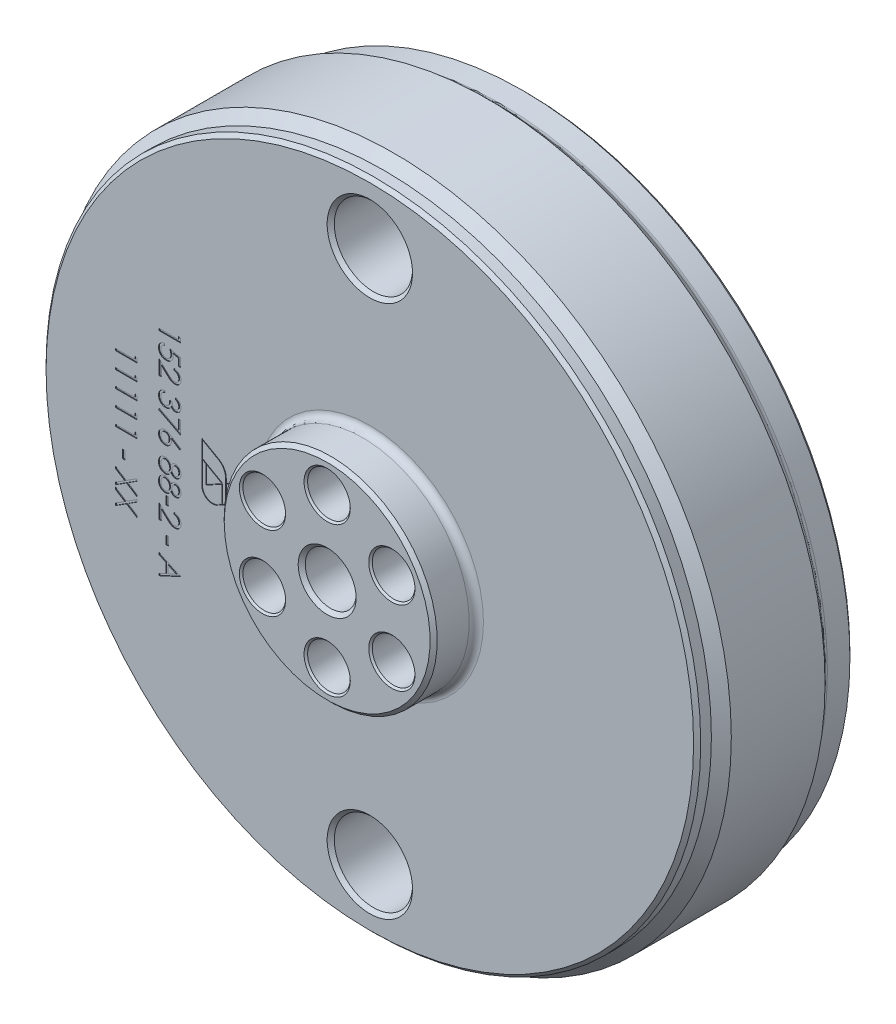
from build123d import *

# Parameters (mm, degrees)
F_11_0_11_DIAMETER_HOLE1_D           = 11
F_11_0_11_DIAMETER_HOLE1_DEPTH       = 10
F_11_0_11_DIAMETER_HOLE1_CSINK_D     = 12
F_11_0_11_DIAMETER_HOLE1_CSINK_ANGLE = 90
F_11_0_11_DIAMETER_HOLE1_TIP         = 3.304733405
CIRPATTERN1_COUNT                    = 6
SKETCH18_W                           = 0.307692308
SKETCH18_H                           = 1.153846154
SKETCH18_W_2                         = 0.307692307
CUT_EXTRUDE1_DEPTH                   = 0.1


with BuildPart() as part:
    # Sketch1 → Revolve1 (revolve)
    with BuildSketch(Plane(origin=(0, 0, 0), x_dir=(0, 0, -1), z_dir=(1, 0, 0)), mode=Mode.PRIVATE) as revolve1_sk:
        with BuildLine():
            Line((0, 36.85), (0, 45.525))
            Line((0, 45.525), (-0.5, 46.025))
            Line((-0.5, 46.025), (-3.66862915, 46.025))
            ThreePointArc((-3.66862915, 46.025), (-3.974775896, 46.085896374), (-4.234314575, 46.259314575))
            Line((-4.234314575, 46.259314575), (-5.4, 47.425))
            Line((-5.4, 47.425), (-18.58, 47.425))
            Line((-18.58, 47.425), (-19.98, 46.025))
            Line((-19.98, 46.025), (-21.48, 46.025))
            Line((-21.48, 46.025), (-21.98, 45.525))
            Line((-21.98, 45.525), (-21.98, 15.975))
            ThreePointArc((-21.98, 15.975), (-22.272893219, 15.267893219), (-22.98, 14.975))
            Line((-22.98, 14.975), (-27.48, 14.975))
            Line((-27.48, 14.975), (-27.98, 14.475))
            Line((-27.98, 14.475), (-27.98, 4.075))
            Line((-27.98, 4.075), (-27.48, 3.575))
            Line((-27.48, 3.575), (-10.7, 3.575))
            Line((-10.7, 3.575), (-8.2, 6.075))
            Line((-8.2, 6.075), (-8.2, 24.107943651))
            ThreePointArc((-8.2, 24.107943651), (-6.29101439, 30.601896882), (-1.171428571, 35.029706236))
            ThreePointArc((-1.171428571, 35.029706236), (-0.318164268, 35.767674461), (0, 36.85))
        make_face()
    revolve(revolve1_sk.sketch.rotate(Axis((0, 0, 0), (0, 0, 1)), 90), axis=Axis((0, 0, 0), (0, 0, 1)))

    # Ø11.0 (11) Diameter Hole1
    with Locations(Plane.XY.offset(21.98)):
        with Locations((0, -37.5), (0, 37.5)):
            CounterSinkHole(F_11_0_11_DIAMETER_HOLE1_D / 2, F_11_0_11_DIAMETER_HOLE1_CSINK_D / 2, depth=F_11_0_11_DIAMETER_HOLE1_DEPTH, counter_sink_angle=F_11_0_11_DIAMETER_HOLE1_CSINK_ANGLE)
            with Locations((0, 0, -(F_11_0_11_DIAMETER_HOLE1_DEPTH + F_11_0_11_DIAMETER_HOLE1_TIP / 2))):  # 118° drill point
                Cone(0, F_11_0_11_DIAMETER_HOLE1_D / 2, F_11_0_11_DIAMETER_HOLE1_TIP, mode=Mode.SUBTRACT)

    # Sketch22 → Ø6.0 (6) Diameter Hole1 (revolve, cut)
    with BuildSketch(Plane(origin=(0, 10.5, 27.98), x_dir=(0, -1, 0), z_dir=(1, 0, 0))):
        Polygon((0, 0), (0, 19.78), (3.25, 19.78), (3, 19.53), (3, 0.25), (3.25, 0), align=None)
    f_6_0_6_diameter_hole1 = revolve(axis=Axis((0, 10.5, 34.33), (0, 0, -1)), mode=Mode.SUBTRACT)

    # CirPattern1: Ø6.0 (6) Diameter Hole1 ×6 about axis
    cirpattern1_axis = Axis((0, 0, 0), (0, 0, 1))
    for i in range(1, CIRPATTERN1_COUNT):
        add(f_6_0_6_diameter_hole1.rotate(cirpattern1_axis, i * 360 / CIRPATTERN1_COUNT), mode=Mode.SUBTRACT)

    # Sketch18 → Cut-Extrude1 (cut)
    # profile 1 of 21: a face of its own
    with BuildSketch(Plane.XY.offset(21.98)):
        Polygon((-26.628822217, 13.250619533), (-26.628822217, 12.695932033), (-29.628822217, 12.695932033), (-29.628822217, 12.965162802), (-26.936514525, 12.965162802), (-26.936514525, 13.426701264), align=None)
    # profile 2 of 21: a face of its own
    with BuildSketch(Plane.XY.offset(21.98)):
        with BuildLine():
            Line((-26.628822217, 9.695932033), (-26.936514525, 9.695932033))
            Line((-26.936514525, 9.695932033), (-26.936514525, 10.715763764))
            Line((-26.936514525, 10.715763764), (-27.725577025, 10.878023379))
            add(Edge.make_bspline(
                [(-27.725577025, 10.878023379), (-27.71680822, 10.846261201), (-27.699820049, 10.784727004), (-27.68095796, 10.693904266), (-27.669587579, 10.607682378), (-27.668035027, 10.55173206), (-27.667283755, 10.524657994)],
                knots=[0, 0, 0, 0, 1.100273476, 2.13160584, 3.095893838, 4, 4, 4, 4], degree=3))
            add(Edge.make_bspline(
                [(-27.667283755, 10.524657994), (-27.668009033, 10.491157762), (-27.66943511, 10.425287934), (-27.68312257, 10.328910051), (-27.704680861, 10.236916394), (-27.73474862, 10.149464138), (-27.773445423, 10.066364921), (-27.821157772, 9.988082806), (-27.877555645, 9.91417414), (-27.942094898, 9.845615968), (-28.013212867, 9.783516462), (-28.089429113, 9.728701035), (-28.170812963, 9.68311229), (-28.257004543, 9.645605746), (-28.347859233, 9.615847925), (-28.444049538, 9.595987422), (-28.544721858, 9.582777507), (-28.613553999, 9.581300563), (-28.648653948, 9.580547417)],
                knots=[0, 0, 0, 0, 1.052772836, 2.070014431, 3.053871312, 4.019926262, 4.972333346, 5.930471369, 6.896690565, 7.89035727, 8.885779078, 9.861050232, 10.836829716, 11.812751485, 12.812646763, 13.836748493, 14.896881366, 16, 16, 16, 16], degree=3))
            add(Edge.make_bspline(
                [(-28.648653948, 9.580547417), (-28.673101597, 9.581117405), (-28.721666507, 9.582249678), (-28.793789638, 9.588009593), (-28.864388101, 9.599093162), (-28.933460839, 9.613995237), (-29.000915509, 9.633260375), (-29.066727573, 9.656835492), (-29.131099679, 9.684624743), (-29.194036042, 9.715999467), (-29.253596435, 9.752294207), (-29.310700262, 9.790526479), (-29.363245982, 9.832877314), (-29.413151864, 9.877296294), (-29.458458026, 9.925559551), (-29.501103313, 9.97616907), (-29.539235304, 10.030312532), (-29.574308126, 10.087020566), (-29.60571097, 10.146257413), (-29.63190655, 10.208623723), (-29.654867203, 10.272750392), (-29.673538927, 10.339208975), (-29.688025487, 10.40787072), (-29.697890637, 10.47897207), (-29.705068392, 10.552156252), (-29.705518121, 10.601763303), (-29.705745294, 10.626821456)],
                knots=[0, 0, 0, 0, 1.05623316, 2.098192244, 3.122504159, 4.140841222, 5.148757784, 6.150489607, 7.158294732, 8.176043417, 9.185147859, 10.169157858, 11.142149047, 12.097904048, 13.0527185, 13.998867679, 14.954465986, 15.910220987, 16.877849176, 17.847023716, 18.829548819, 19.818454515, 20.826519638, 21.858115382, 22.918063636, 24, 24, 24, 24], degree=3))
            add(Edge.make_bspline(
                [(-29.705745294, 10.626821456), (-29.705153095, 10.656713574), (-29.703988014, 10.715522786), (-29.691801481, 10.801683793), (-29.674343995, 10.884580122), (-29.648094174, 10.96355572), (-29.61515447, 11.039276907), (-29.573787959, 11.110735688), (-29.526255956, 11.179336619), (-29.470918445, 11.243215208), (-29.409866768, 11.302381948), (-29.344324097, 11.356159376), (-29.274029824, 11.403321858), (-29.19958239, 11.444061861), (-29.120853694, 11.478762301), (-29.037608154, 11.506035642), (-28.950264541, 11.528044742), (-28.890133064, 11.537356372), (-28.859591448, 11.542085879)],
                knots=[0, 0, 0, 0, 1.046825758, 2.059506013, 3.044032586, 4.011925612, 4.970610144, 5.93275819, 6.900651216, 7.891265644, 8.889116719, 9.876966323, 10.858259055, 11.851035124, 12.847502422, 13.86866322, 14.9174643, 16, 16, 16, 16], degree=3))
            Line((-28.859591448, 11.542085879), (-28.859591448, 11.27285511))
            add(Edge.make_bspline(
                [(-28.859591448, 11.27285511), (-28.888202565, 11.266234801), (-28.943194721, 11.2535102), (-29.020413833, 11.225506934), (-29.089485567, 11.191478853), (-29.150475131, 11.150095268), (-29.203938981, 11.101727901), (-29.251994253, 11.046931829), (-29.294773601, 10.98492641), (-29.330661809, 10.916051173), (-29.361224019, 10.843345127), (-29.381585545, 10.767261375), (-29.39589983, 10.689857015), (-29.39733287, 10.637504212), (-29.398052986, 10.611196456)],
                knots=[0, 0, 0, 0, 1.136389429, 2.184203582, 3.172920998, 4.111012962, 5.028380909, 5.957351669, 6.927793475, 7.937618031, 8.960409703, 9.974842029, 10.982339866, 12, 12, 12, 12], degree=3))
            add(Edge.make_bspline(
                [(-29.398052986, 10.611196456), (-29.397349462, 10.585517789), (-29.395964218, 10.534956284), (-29.385302208, 10.460546524), (-29.368881432, 10.388706918), (-29.344307271, 10.320146326), (-29.314440369, 10.253665007), (-29.276113161, 10.190944632), (-29.232004574, 10.130170737), (-29.18147032, 10.073232337), (-29.12578201, 10.021084238), (-29.066229959, 9.975007563), (-29.002701233, 9.936627351), (-28.936295673, 9.904283829), (-28.866285482, 9.879723859), (-28.79299876, 9.862203018), (-28.716254491, 9.851914682), (-28.663909369, 9.850499385), (-28.637235679, 9.849778187)],
                knots=[0, 0, 0, 0, 1.027316725, 2.022795036, 3.002884548, 3.971462791, 4.93288096, 5.914575861, 6.907176829, 7.935150275, 8.956128384, 9.956726525, 10.942570165, 11.921478529, 12.907843606, 13.90538589, 14.932640048, 16, 16, 16, 16], degree=3))
            add(Edge.make_bspline(
                [(-28.637235679, 9.849778187), (-28.613156248, 9.850251689), (-28.565997179, 9.851179035), (-28.497306463, 9.861484119), (-28.431840212, 9.875919942), (-28.370183867, 9.898084308), (-28.311434561, 9.925470263), (-28.256849744, 9.960214621), (-28.205027037, 9.999931002), (-28.158071716, 10.046449868), (-28.114441636, 10.097176716), (-28.07730271, 10.153289084), (-28.046044376, 10.213507095), (-28.019072786, 10.277133787), (-27.999700445, 10.34567476), (-27.98515662, 10.417774835), (-27.976743431, 10.494211984), (-27.975576101, 10.546472578), (-27.974976063, 10.573335879)],
                knots=[0, 0, 0, 0, 1.045726679, 2.048034203, 3.01323695, 3.95502507, 4.889743367, 5.8246644, 6.761650845, 7.722168973, 8.692072792, 9.66525385, 10.638902184, 11.638179751, 12.663148338, 13.728659964, 14.832472288, 16, 16, 16, 16], degree=3))
            add(Edge.make_bspline(
                [(-27.974976063, 10.573335879), (-27.975456814, 10.596791184), (-27.976440985, 10.644807836), (-27.984186208, 10.718633355), (-27.996101488, 10.795875298), (-28.013275209, 10.876833542), (-28.03477789, 10.961285912), (-28.061632043, 11.049372853), (-28.092564641, 11.141096492), (-28.116557018, 11.20283307), (-28.128822217, 11.234393571)],
                knots=[0, 0, 0, 0, 0.824638674, 1.688163388, 2.607705698, 3.571998603, 4.597075385, 5.671199175, 6.809488238, 8, 8, 8, 8], degree=3))
            Line((-28.128822217, 11.234393571), (-26.628822217, 10.926701264))
            Line((-26.628822217, 10.926701264), (-26.628822217, 9.695932033))
        make_face()
    # profile 3 of 21: a face of its own
    with BuildSketch(Plane.XY.offset(21.98)):
        with BuildLine():
            Line((-27.55189914, 8.888239725), (-27.55189914, 9.157470494))
            add(Edge.make_bspline(
                [(-27.55189914, 9.157470494), (-27.51618106, 9.15571609), (-27.446031702, 9.152270488), (-27.343756559, 9.136127728), (-27.245986286, 9.113050843), (-27.153559084, 9.080345514), (-27.065370832, 9.03995729), (-26.982592567, 8.990510416), (-26.904402726, 8.933059019), (-26.832281702, 8.867708496), (-26.766354068, 8.796797156), (-26.708819713, 8.720749867), (-26.660764983, 8.640348253), (-26.620373874, 8.556289682), (-26.590092255, 8.467601993), (-26.567613922, 8.375132939), (-26.554092061, 8.278464571), (-26.552638431, 8.212601769), (-26.55189914, 8.17910511)],
                knots=[0, 0, 0, 0, 1.100776268, 2.161895295, 3.184016182, 4.190939212, 5.176500551, 6.166955529, 7.155448256, 8.160289653, 9.16017456, 10.133824356, 11.091467644, 12.04088621, 13.000931625, 13.972173743, 14.968683325, 16, 16, 16, 16], degree=3))
            add(Edge.make_bspline(
                [(-26.55189914, 8.17910511), (-26.552669246, 8.146209618), (-26.554182475, 8.081571151), (-26.567177643, 7.987232281), (-26.587531008, 7.897423172), (-26.616087079, 7.812319372), (-26.654473731, 7.732599888), (-26.700585907, 7.65766585), (-26.753917191, 7.586625155), (-26.816706174, 7.522676483), (-26.883736789, 7.463955272), (-26.955297849, 7.413296196), (-27.029208666, 7.369913485), (-27.106032838, 7.333752616), (-27.18649372, 7.307133069), (-27.269419894, 7.286923176), (-27.355669732, 7.275499679), (-27.414046779, 7.273746459), (-27.443726063, 7.27285511)],
                knots=[0, 0, 0, 0, 1.111607364, 2.184268762, 3.212621178, 4.221274766, 5.211760367, 6.196651075, 7.1921475, 8.207485113, 9.220403448, 10.201281604, 11.166441695, 12.114753415, 13.065576456, 14.026450734, 14.996634279, 16, 16, 16, 16], degree=3))
            add(Edge.make_bspline(
                [(-27.443726063, 7.27285511), (-27.485509907, 7.274304523), (-27.568344347, 7.277177916), (-27.690258855, 7.301856794), (-27.808284761, 7.34025143), (-27.903643566, 7.385879093), (-27.980003694, 7.432628056), (-28.042989268, 7.474678147), (-28.110790087, 7.523941471), (-28.183200423, 7.58109208), (-28.260780833, 7.644960991), (-28.343486482, 7.716122624), (-28.430462252, 7.795085674), (-28.489867058, 7.850507237), (-28.52064914, 7.879225302)],
                knots=[0, 0, 0, 0, 1.184136889, 2.347493852, 3.513608722, 4.697895552, 5.335178528, 6.052199267, 6.845488095, 7.711597353, 8.668264519, 9.695616787, 10.805926351, 12, 12, 12, 12], degree=3))
            Line((-28.52064914, 7.879225302), (-29.321129909, 8.629826264))
            Line((-29.321129909, 8.629826264), (-29.321129909, 7.234393571))
            Line((-29.321129909, 7.234393571), (-29.628822217, 7.234393571))
            Line((-29.628822217, 7.234393571), (-29.628822217, 9.27285511))
            Line((-29.628822217, 9.27285511), (-28.387235679, 8.109393571))
            add(Edge.make_bspline(
                [(-28.387235679, 8.109393571), (-28.357667314, 8.081064806), (-28.300872538, 8.026651044), (-28.217928782, 7.949720935), (-28.141071065, 7.880514184), (-28.069958814, 7.818984883), (-28.004995167, 7.765082406), (-27.94567102, 7.718979216), (-27.892495475, 7.680471545), (-27.830027069, 7.639661439), (-27.753666329, 7.600746295), (-27.660818905, 7.566543865), (-27.565028397, 7.545838179), (-27.500315611, 7.543341653), (-27.467764525, 7.542085879)],
                knots=[0, 0, 0, 0, 1.329530082, 2.553755191, 3.672934919, 4.687409497, 5.60679272, 6.413407421, 7.126401618, 7.737995624, 8.834647426, 9.90044882, 10.943907757, 12, 12, 12, 12], degree=3))
            add(Edge.make_bspline(
                [(-27.467764525, 7.542085879), (-27.447292493, 7.542625203), (-27.406946049, 7.543688109), (-27.347830711, 7.553246448), (-27.29058597, 7.567289546), (-27.235919617, 7.588934297), (-27.18275647, 7.614939669), (-27.132712854, 7.64816345), (-27.084082903, 7.686129507), (-27.038534097, 7.73016827), (-26.996804317, 7.77851465), (-26.959841607, 7.829597094), (-26.928950734, 7.883639607), (-26.903627792, 7.940416971), (-26.883763165, 7.999770199), (-26.869998672, 8.061814275), (-26.861356542, 8.126377715), (-26.860187252, 8.170463569), (-26.859591448, 8.192927225)],
                knots=[0, 0, 0, 0, 0.991504627, 1.954065223, 2.895985987, 3.842598665, 4.797835564, 5.759220273, 6.74786863, 7.784730864, 8.824135544, 9.839918996, 10.835834653, 11.835434876, 12.84861661, 13.863796685, 14.911511676, 16, 16, 16, 16], degree=3))
            add(Edge.make_bspline(
                [(-26.859591448, 8.192927225), (-26.860204147, 8.216388043), (-26.861407388, 8.262461216), (-26.869829444, 8.330104624), (-26.884344878, 8.394640667), (-26.90424523, 8.456199986), (-26.929299932, 8.514841892), (-26.961108762, 8.570036145), (-26.998429786, 8.62228665), (-27.040973717, 8.671497442), (-27.088564146, 8.716714439), (-27.140961946, 8.757277759), (-27.198507959, 8.791873983), (-27.259902395, 8.822541979), (-27.326777654, 8.846007534), (-27.397513196, 8.866065665), (-27.473114003, 8.880636414), (-27.525201247, 8.885663194), (-27.55189914, 8.888239725)],
                knots=[0, 0, 0, 0, 1.031212865, 2.025131798, 2.990757446, 3.934781266, 4.865570067, 5.788494791, 6.729227313, 7.684356718, 8.643577152, 9.610526866, 10.590658432, 11.59095419, 12.621640561, 13.700587263, 14.82141059, 16, 16, 16, 16], degree=3))
        make_face()
    # profile 4 of 21: a face of its own
    with BuildSketch(Plane.XY.offset(21.98)):
        with BuildLine():
            Line((-27.321129909, 5.426701264), (-27.321129909, 5.695932033))
            add(Edge.make_bspline(
                [(-27.321129909, 5.695932033), (-27.290930637, 5.688638132), (-27.231893531, 5.674379153), (-27.14754445, 5.644638376), (-27.067724289, 5.612239014), (-26.993927654, 5.573334067), (-26.924671452, 5.530897992), (-26.861526488, 5.482278517), (-26.802886803, 5.429718755), (-26.750846885, 5.371583084), (-26.703723118, 5.31061566), (-26.663544497, 5.245957414), (-26.628980937, 5.178909219), (-26.600506453, 5.109006534), (-26.579056004, 5.036041244), (-26.563493028, 4.960672996), (-26.553386358, 4.882704281), (-26.55239999, 4.829777775), (-26.55189914, 4.802903187)],
                knots=[0, 0, 0, 0, 1.162005537, 2.271625781, 3.343758855, 4.383309926, 5.390229558, 6.379919256, 7.361854164, 8.333198761, 9.295911338, 10.242430842, 11.177959212, 12.116337295, 13.062827104, 14.020064771, 14.994644689, 16, 16, 16, 16], degree=3))
            add(Edge.make_bspline(
                [(-26.55189914, 4.802903187), (-26.553081337, 4.763746551), (-26.555419945, 4.686287398), (-26.576775176, 4.572490501), (-26.610568147, 4.462753227), (-26.657259913, 4.358276729), (-26.714849039, 4.261232358), (-26.783390242, 4.174887056), (-26.861561071, 4.100411189), (-26.947903269, 4.037930294), (-27.04017942, 3.989008866), (-27.135150984, 3.952934832), (-27.232592673, 3.930973391), (-27.298384627, 3.928127199), (-27.331346255, 3.926701264)],
                knots=[0, 0, 0, 0, 1.083050992, 2.142477498, 3.193116406, 4.255571735, 5.30263384, 6.308962982, 7.297363603, 8.282367274, 9.249857812, 10.179914175, 11.08814088, 12, 12, 12, 12], degree=3))
            add(Edge.make_bspline(
                [(-27.331346255, 3.926701264), (-27.363066365, 3.927698627), (-27.425137698, 3.929650313), (-27.515756124, 3.946222061), (-27.60116321, 3.974110286), (-27.681718492, 4.012741511), (-27.756911211, 4.062748554), (-27.826910546, 4.123325152), (-27.892026968, 4.194898862), (-27.929329373, 4.249137952), (-27.948533755, 4.27706184)],
                knots=[0, 0, 0, 0, 1.024540389, 2.004866551, 2.965041327, 3.920577974, 4.882998113, 5.874504559, 6.905732034, 8, 8, 8, 8], degree=3))
            add(Edge.make_bspline(
                [(-27.948533755, 4.27706184), (-27.963943617, 4.245148908), (-27.994475009, 4.181920159), (-28.054351373, 4.09573399), (-28.123485385, 4.017495812), (-28.17743623, 3.973864052), (-28.204543371, 3.951941648)],
                knots=[0, 0, 0, 0, 1.015518401, 2.012035669, 3.001164323, 4, 4, 4, 4], degree=3))
            add(Edge.make_bspline(
                [(-28.204543371, 3.951941648), (-28.224305052, 3.937500336), (-28.263504802, 3.908854198), (-28.326566795, 3.8735953), (-28.390118994, 3.841242885), (-28.456660188, 3.817432445), (-28.524052957, 3.796884978), (-28.59374045, 3.783365429), (-28.665060576, 3.774686419), (-28.713332038, 3.773467709), (-28.737596255, 3.77285511)],
                knots=[0, 0, 0, 0, 1.02516404, 2.033540309, 3.025129118, 4.011046665, 4.991655828, 5.976607087, 6.982917762, 8, 8, 8, 8], degree=3))
            add(Edge.make_bspline(
                [(-28.737596255, 3.77285511), (-28.779602917, 3.774396651), (-28.863418557, 3.777472479), (-28.98727909, 3.804853739), (-29.108145438, 3.847546947), (-29.224226756, 3.907114835), (-29.332609536, 3.98081596), (-29.429142704, 4.068984251), (-29.512678917, 4.169476351), (-29.582250329, 4.28163456), (-29.637904457, 4.403095718), (-29.676522349, 4.533020556), (-29.701676818, 4.669519812), (-29.70437403, 4.763126176), (-29.705745294, 4.810715687)],
                knots=[0, 0, 0, 0, 0.95570045, 1.906903359, 2.87519758, 3.868912786, 4.869932978, 5.851730567, 6.836639976, 7.83677598, 8.849487602, 9.869908895, 10.917060885, 12, 12, 12, 12], degree=3))
            add(Edge.make_bspline(
                [(-29.705745294, 4.810715687), (-29.705001111, 4.842789373), (-29.703536808, 4.905899691), (-29.693526578, 4.998679833), (-29.675243716, 5.087241289), (-29.650640883, 5.171703802), (-29.619447961, 5.252142404), (-29.580603363, 5.328311637), (-29.53490779, 5.400680118), (-29.481821857, 5.468564933), (-29.422437852, 5.531957991), (-29.355701558, 5.589174612), (-29.28284664, 5.64116872), (-29.203026878, 5.686548124), (-29.1172738, 5.727379798), (-29.024489373, 5.760963475), (-28.925503068, 5.790522534), (-28.856522148, 5.804265503), (-28.821129909, 5.811316648)],
                knots=[0, 0, 0, 0, 1.048658725, 2.063410685, 3.046034179, 4.001477787, 4.936774919, 5.862367409, 6.792675028, 7.730719943, 8.675894397, 9.627829632, 10.600096036, 11.597688215, 12.626045268, 13.701542398, 14.82072376, 16, 16, 16, 16], degree=3))
            Line((-28.821129909, 5.811316648), (-28.821129909, 5.542085879))
            add(Edge.make_bspline(
                [(-28.821129909, 5.542085879), (-28.844229064, 5.535071629), (-28.889158925, 5.521428304), (-28.953822044, 5.49820462), (-29.013100375, 5.471746101), (-29.067428766, 5.443362194), (-29.117342254, 5.413552097), (-29.161520998, 5.380196447), (-29.201905457, 5.345765751), (-29.224657982, 5.31981202), (-29.235793371, 5.307109917)],
                knots=[0, 0, 0, 0, 1.198163088, 2.33053128, 3.407730985, 4.417276592, 5.372219308, 6.28897303, 7.162600585, 8, 8, 8, 8], degree=3))
            add(Edge.make_bspline(
                [(-29.235793371, 5.307109917), (-29.248743371, 5.290312852), (-29.274603399, 5.256770569), (-29.307604794, 5.202112086), (-29.336199959, 5.144627897), (-29.358043127, 5.083072462), (-29.376538265, 5.018774088), (-29.388641567, 4.950693489), (-29.396945714, 4.879431303), (-29.397678512, 4.83077322), (-29.398052986, 4.805907994)],
                knots=[0, 0, 0, 0, 0.946170439, 1.889420265, 2.845303464, 3.807233317, 4.801018734, 5.828864929, 6.890507805, 8, 8, 8, 8], degree=3))
            add(Edge.make_bspline(
                [(-29.398052986, 4.805907994), (-29.397525926, 4.777833183), (-29.396495305, 4.722935314), (-29.386989847, 4.642836459), (-29.373206637, 4.566611104), (-29.351647016, 4.495037131), (-29.32578269, 4.427140593), (-29.291921539, 4.364437136), (-29.253680844, 4.305083357), (-29.20919956, 4.250818047), (-29.161120108, 4.201895217), (-29.110112093, 4.159620486), (-29.057757097, 4.123005735), (-29.002833783, 4.093573585), (-28.945880906, 4.070291373), (-28.886685288, 4.054451382), (-28.825745396, 4.043435065), (-28.784320481, 4.042538068), (-28.763437602, 4.042085879)],
                knots=[0, 0, 0, 0, 1.216990249, 2.379719373, 3.493992396, 4.571561497, 5.616923107, 6.638958652, 7.655775068, 8.674704564, 9.676001865, 10.625896028, 11.54399481, 12.441854662, 13.322657739, 14.20572845, 15.095482574, 16, 16, 16, 16], degree=3))
            add(Edge.make_bspline(
                [(-28.763437602, 4.042085879), (-28.735484994, 4.043397543), (-28.679718867, 4.046014343), (-28.597675705, 4.065993475), (-28.51862522, 4.098853998), (-28.443927488, 4.144864338), (-28.374663352, 4.200846006), (-28.313104514, 4.2662571), (-28.261798772, 4.341258075), (-28.226481824, 4.410731798), (-28.202944563, 4.472417801), (-28.186440676, 4.525102549), (-28.173247761, 4.584136906), (-28.16048624, 4.648812176), (-28.14978779, 4.719401129), (-28.140827419, 4.795967359), (-28.133668977, 4.87854167), (-28.130470463, 4.935705412), (-28.128822217, 4.965162802)],
                knots=[0, 0, 0, 0, 1.070481957, 2.135637345, 3.216366529, 4.339485895, 5.485746587, 6.620975969, 7.768829582, 8.956804399, 9.598399438, 10.297751078, 11.070570279, 11.915248466, 12.824061284, 13.805856426, 14.869322739, 16, 16, 16, 16], degree=3))
            Line((-28.128822217, 4.965162802), (-27.821129909, 4.965162802))
            add(Edge.make_bspline(
                [(-27.821129909, 4.965162802), (-27.820497331, 4.928048543), (-27.819258267, 4.855350827), (-27.804375772, 4.749141268), (-27.783557121, 4.647458168), (-27.752404777, 4.55262256), (-27.715013074, 4.466465124), (-27.672851198, 4.391306253), (-27.625083684, 4.328927184), (-27.572337435, 4.279172067), (-27.515105856, 4.242653579), (-27.456080001, 4.215242836), (-27.393886535, 4.199173547), (-27.351466548, 4.197016342), (-27.330144332, 4.195932033)],
                knots=[0, 0, 0, 0, 1.321708579, 2.588902423, 3.815526512, 5.016621128, 6.138757764, 7.158873101, 8.079948563, 8.928590313, 9.728601868, 10.489025425, 11.240515403, 12, 12, 12, 12], degree=3))
            add(Edge.make_bspline(
                [(-27.330144332, 4.195932033), (-27.314477656, 4.196287201), (-27.283309546, 4.196993791), (-27.237774326, 4.20590635), (-27.193628595, 4.21929612), (-27.151072661, 4.237715994), (-27.110353538, 4.262325734), (-27.071421271, 4.291865621), (-27.033623397, 4.326349912), (-26.998768211, 4.366679853), (-26.965890846, 4.410341315), (-26.937469587, 4.457745125), (-26.913379746, 4.507845735), (-26.893476403, 4.560689215), (-26.87851391, 4.616487255), (-26.867768172, 4.674966637), (-26.861050385, 4.736241941), (-26.860083144, 4.778046262), (-26.859591448, 4.799297417)],
                knots=[0, 0, 0, 0, 0.884317272, 1.759307272, 2.611736065, 3.488921043, 4.37244062, 5.294096728, 6.247679003, 7.258495569, 8.302441962, 9.333537773, 10.376747089, 11.440883505, 12.520330301, 13.637364711, 14.798958396, 16, 16, 16, 16], degree=3))
            add(Edge.make_bspline(
                [(-26.859591448, 4.799297417), (-26.86078173, 4.833457119), (-26.863106629, 4.90017896), (-26.883541443, 4.996347448), (-26.915918299, 5.085656786), (-26.955013256, 5.153692486), (-26.993472221, 5.204017695), (-27.026558468, 5.240669099), (-27.064071496, 5.276004807), (-27.107040245, 5.308638214), (-27.153987192, 5.340524782), (-27.205170905, 5.371360042), (-27.261321111, 5.400153566), (-27.300807553, 5.417680655), (-27.321129909, 5.426701264)],
                knots=[0, 0, 0, 0, 1.4727372, 2.876598283, 4.222346151, 5.558423782, 6.24313385, 6.953189256, 7.68715613, 8.463578749, 9.278833271, 10.135787152, 11.040551781, 12, 12, 12, 12], degree=3))
        make_face()
    # profile 5 of 21: a face of its own
    with BuildSketch(Plane.XY.offset(21.98)):
        Polygon((-26.628822217, 3.311316648), (-26.628822217, 1.465162802), (-29.705745294, 3.042085879), (-29.577740486, 3.274657994), (-26.936514525, 1.92129261), (-26.936514525, 3.311316648), align=None)
    # profile 6 of 21: a face of its own
    with BuildSketch(Plane.XY.offset(21.98)):
        with BuildLine():
            Line((-26.55189914, -0.188683352), (-26.714759717, -0.396616044))
            Line((-26.714759717, -0.396616044), (-27.92689914, 0.396052225))
            add(Edge.make_bspline(
                [(-27.92689914, 0.396052225), (-27.91848726, 0.343277702), (-27.902078935, 0.240335028), (-27.899372125, 0.136135686), (-27.898052986, 0.08535511)],
                knots=[0, 0, 0, 0, 1.025318673, 2, 2, 2, 2], degree=3))
            add(Edge.make_bspline(
                [(-27.898052986, 0.08535511), (-27.898860641, 0.054862864), (-27.900445227, -0.004961687), (-27.912967724, -0.092865487), (-27.932458922, -0.177351824), (-27.960985473, -0.25823222), (-27.997414072, -0.335609324), (-28.041076501, -0.409925592), (-28.094224079, -0.479784478), (-28.153594082, -0.546085483), (-28.219351486, -0.606280139), (-28.289124064, -0.659573901), (-28.362839104, -0.704339722), (-28.440459275, -0.740660227), (-28.521864926, -0.768864408), (-28.606951903, -0.789425247), (-28.695778878, -0.801579184), (-28.756188743, -0.803229604), (-28.786875102, -0.804067967)],
                knots=[0, 0, 0, 0, 1.044136307, 2.048553127, 3.035567123, 4.010001674, 4.980053131, 5.96154148, 6.956538004, 7.981742224, 9.006487041, 10.005615874, 10.984750588, 11.954802044, 12.935714515, 13.930994945, 14.949008866, 16, 16, 16, 16], degree=3))
            add(Edge.make_bspline(
                [(-28.786875102, -0.804067967), (-28.828832748, -0.802502371), (-28.911346786, -0.799423465), (-29.032030284, -0.777010338), (-29.146080075, -0.738330287), (-29.253944354, -0.686581018), (-29.352484805, -0.61944041), (-29.441538949, -0.539875098), (-29.519162718, -0.447132968), (-29.585752916, -0.343410173), (-29.638658744, -0.231149898), (-29.677773103, -0.113441327), (-29.701144926, 0.00870943), (-29.704204784, 0.091666601), (-29.705745294, 0.133432033)],
                knots=[0, 0, 0, 0, 1.031881447, 2.029301251, 3.006342947, 3.987068354, 4.962916383, 5.929513747, 6.915671209, 7.928552063, 8.953527267, 9.960179832, 10.973036711, 12, 12, 12, 12], degree=3))
            add(Edge.make_bspline(
                [(-29.705745294, 0.133432033), (-29.704435407, 0.173800641), (-29.701840749, 0.253763786), (-29.67872704, 0.371391782), (-29.641263992, 0.484417656), (-29.589651064, 0.592046932), (-29.524461157, 0.69175635), (-29.44596975, 0.780933216), (-29.355911594, 0.859267267), (-29.254010422, 0.924114002), (-29.14521614, 0.976964267), (-29.030740922, 1.014240323), (-28.912888629, 1.038346845), (-28.832665191, 1.04083396), (-28.792283755, 1.042085879)],
                knots=[0, 0, 0, 0, 1.011913813, 2.004424092, 2.994488568, 3.992479987, 4.990471406, 5.973328987, 6.963763268, 7.974390938, 8.994854117, 9.989689954, 10.988086187, 12, 12, 12, 12], degree=3))
            add(Edge.make_bspline(
                [(-28.792283755, 1.042085879), (-28.761399648, 1.040998638), (-28.698368261, 1.038779686), (-28.602629313, 1.02553724), (-28.505051687, 1.001248976), (-28.422332556, 0.974963766), (-28.353826128, 0.948880904), (-28.299728412, 0.924696273), (-28.242599486, 0.897654909), (-28.183520287, 0.865958665), (-28.120802794, 0.832358088), (-28.056769627, 0.793108801), (-27.989082096, 0.752151568), (-27.94401679, 0.722147342), (-27.920889525, 0.70674934)],
                knots=[0, 0, 0, 0, 1.17367173, 2.395347028, 3.66355231, 4.98980831, 5.690886799, 6.447442954, 7.240630024, 8.091733897, 8.994365608, 9.943299771, 10.944512865, 12, 12, 12, 12], degree=3))
            Line((-27.920889525, 0.70674934), (-26.55189914, -0.188683352))
        make_face()
        with BuildLine():
            add(Edge.make_bspline(
                [(-28.205745294, 0.141845494), (-28.206421024, 0.164698129), (-28.207746801, 0.209534809), (-28.215234769, 0.275233742), (-28.229422502, 0.337245535), (-28.24777439, 0.396278898), (-28.27276277, 0.451716982), (-28.30275233, 0.504197966), (-28.338421284, 0.553179575), (-28.379311107, 0.597882168), (-28.423695616, 0.638779694), (-28.47087143, 0.674782998), (-28.520647346, 0.705133962), (-28.572595096, 0.729931898), (-28.626986151, 0.749197801), (-28.683520384, 0.763145088), (-28.7425904, 0.770904618), (-28.782646747, 0.772195788), (-28.803101063, 0.77285511)],
                knots=[0, 0, 0, 0, 1.129054775, 2.21519617, 3.259426851, 4.267013074, 5.263608451, 6.256463875, 7.247987236, 8.249677815, 9.244060445, 10.225610515, 11.175892485, 12.118571871, 13.063688666, 14.021206195, 14.989551517, 16, 16, 16, 16], degree=3))
            add(Edge.make_bspline(
                [(-28.803101063, 0.77285511), (-28.823371703, 0.772316845), (-28.86311941, 0.771261388), (-28.92170686, 0.761721998), (-28.978035481, 0.747046454), (-29.03214647, 0.725565348), (-29.083744662, 0.698621759), (-29.133196572, 0.665464702), (-29.180536334, 0.626655605), (-29.224570207, 0.581540801), (-29.264959146, 0.532888859), (-29.300921532, 0.481436207), (-29.331120321, 0.427346446), (-29.354994843, 0.370310933), (-29.374548646, 0.311128212), (-29.388318344, 0.249346796), (-29.396100918, 0.184912401), (-29.397393756, 0.141265097), (-29.398052986, 0.119008956)],
                knots=[0, 0, 0, 0, 0.989642335, 1.94054129, 2.892446913, 3.828371744, 4.778262963, 5.730973156, 6.732161388, 7.763274768, 8.805796303, 9.818398792, 10.825975928, 11.825728216, 12.834635236, 13.867465554, 14.912602056, 16, 16, 16, 16], degree=3))
            add(Edge.make_bspline(
                [(-29.398052986, 0.119008956), (-29.397393808, 0.096752778), (-29.396101071, 0.053105402), (-29.388317763, -0.011328474), (-29.374550781, -0.073111806), (-29.354987106, -0.132287564), (-29.331149022, -0.189348782), (-29.300732302, -0.243485891), (-29.265177799, -0.295429779), (-29.224500693, -0.344049804), (-29.180785146, -0.389353176), (-29.132767943, -0.427253278), (-29.084137698, -0.461457841), (-29.031940854, -0.487366603), (-28.978068055, -0.509086942), (-28.921698134, -0.523688441), (-28.863121694, -0.533247573), (-28.823372474, -0.534300317), (-28.803101063, -0.534837198)],
                knots=[0, 0, 0, 0, 1.087205562, 2.132157158, 3.164804748, 4.173533273, 5.173108684, 6.180507559, 7.20098426, 8.243321352, 9.274252308, 10.269075238, 11.227079059, 12.172305571, 13.108064818, 14.05980203, 15.010532752, 16, 16, 16, 16], degree=3))
            add(Edge.make_bspline(
                [(-28.803101063, -0.534837198), (-28.782617642, -0.534371016), (-28.742415349, -0.533456052), (-28.683574121, -0.522906902), (-28.626524504, -0.508658519), (-28.572551631, -0.485631826), (-28.520162935, -0.458205156), (-28.470855725, -0.423265379), (-28.423233118, -0.38320607), (-28.37904829, -0.336813503), (-28.338633252, -0.286342544), (-28.302960203, -0.232670356), (-28.272852868, -0.176521108), (-28.247732503, -0.11794904), (-28.229604565, -0.056283738), (-28.215329597, 0.007479395), (-28.207759228, 0.073956741), (-28.206423228, 0.118992669), (-28.205745294, 0.141845494)],
                knots=[0, 0, 0, 0, 0.978850575, 1.921165339, 2.853482305, 3.786193361, 4.721019802, 5.678231452, 6.671107257, 7.694736563, 8.738100728, 9.761595396, 10.773671158, 11.783065439, 12.804898115, 13.84455739, 14.906252091, 16, 16, 16, 16], degree=3))
        make_face(mode=Mode.SUBTRACT)
    # profile 7 of 21: a face of its own
    with BuildSketch(Plane.XY.offset(21.98)):
        with BuildLine():
            add(Edge.make_bspline(
                [(-27.957548179, -3.724140083), (-27.970367794, -3.74848838), (-27.995448533, -3.796124233), (-28.035702991, -3.864282104), (-28.077754049, -3.927033916), (-28.12028169, -3.985273966), (-28.164966904, -4.037814353), (-28.211299639, -4.085002739), (-28.258038789, -4.128319544), (-28.307013179, -4.165487447), (-28.357212701, -4.198262696), (-28.409068868, -4.2265496), (-28.462418118, -4.250738217), (-28.51785598, -4.269905801), (-28.574564618, -4.285696085), (-28.633277216, -4.296560842), (-28.69360664, -4.302403927), (-28.734379471, -4.303508622), (-28.75502414, -4.304067967)],
                knots=[0, 0, 0, 0, 1.264385854, 2.473688339, 3.635349404, 4.734491366, 5.785876313, 6.801388178, 7.772322209, 8.711311751, 9.622826105, 10.524996139, 11.423212571, 12.31118177, 13.217849097, 14.126010572, 15.051135535, 16, 16, 16, 16], degree=3))
            add(Edge.make_bspline(
                [(-28.75502414, -4.304067967), (-28.783909894, -4.303412631), (-28.84108564, -4.302115476), (-28.925439186, -4.290629976), (-29.00755858, -4.273867129), (-29.08664991, -4.247763752), (-29.163704286, -4.216584894), (-29.23731283, -4.176475117), (-29.309533821, -4.13146321), (-29.353945937, -4.095235598), (-29.376418371, -4.076904506)],
                knots=[0, 0, 0, 0, 1.02534174, 2.029536028, 3.018826961, 3.997522084, 4.983122576, 5.966563916, 6.971085759, 8, 8, 8, 8], degree=3))
            add(Edge.make_bspline(
                [(-29.376418371, -4.076904506), (-29.402641606, -4.053044671), (-29.454764028, -4.005619843), (-29.522436151, -3.924377334), (-29.57930706, -3.835215719), (-29.625654398, -3.738480005), (-29.661727992, -3.634428775), (-29.68765015, -3.5230842), (-29.702497946, -3.404229212), (-29.704644223, -3.322538808), (-29.705745294, -3.280630467)],
                knots=[0, 0, 0, 0, 0.954267603, 1.896743057, 2.838368354, 3.796610408, 4.779680527, 5.799409237, 6.871065594, 8, 8, 8, 8], degree=3))
            add(Edge.make_bspline(
                [(-29.705745294, -3.280630467), (-29.704754805, -3.240334205), (-29.702827413, -3.161921772), (-29.689840111, -3.047773673), (-29.666847624, -2.941240529), (-29.636028437, -2.841817271), (-29.594930351, -2.750465198), (-29.544555976, -2.667018544), (-29.486043131, -2.59025304), (-29.417981644, -2.52258136), (-29.345072863, -2.462506413), (-29.269857716, -2.409733577), (-29.192326134, -2.365870137), (-29.113634997, -2.328732612), (-29.032681142, -2.300302882), (-28.949881133, -2.280612415), (-28.865379581, -2.268107289), (-28.80835245, -2.266443459), (-28.779663563, -2.265606429)],
                knots=[0, 0, 0, 0, 1.256882982, 2.445766618, 3.576898315, 4.651879663, 5.686612882, 6.692806257, 7.686348993, 8.689277895, 9.678883454, 10.630458183, 11.551151498, 12.454054546, 13.341321255, 14.221808008, 15.105437234, 16, 16, 16, 16], degree=3))
            add(Edge.make_bspline(
                [(-28.779663563, -2.265606429), (-28.758612811, -2.266101731), (-28.717009095, -2.267080624), (-28.655544187, -2.273856554), (-28.595718075, -2.284748241), (-28.537314882, -2.299546796), (-28.480740938, -2.319578695), (-28.425798562, -2.343851804), (-28.372065617, -2.371880546), (-28.320465834, -2.405476062), (-28.269279562, -2.44246309), (-28.221006949, -2.486338112), (-28.172958823, -2.534458726), (-28.127214223, -2.588789638), (-28.081574483, -2.647667914), (-28.038944044, -2.712878108), (-27.996203761, -2.782588114), (-27.970654455, -2.832136319), (-27.957548179, -2.857553544)],
                knots=[0, 0, 0, 0, 0.941717298, 1.86116577, 2.762973304, 3.660719123, 4.553575492, 5.444450535, 6.34648071, 7.261375261, 8.197060099, 9.168336537, 10.175980388, 11.237504102, 12.343496232, 13.506792996, 14.721035322, 16, 16, 16, 16], degree=3))
            add(Edge.make_bspline(
                [(-27.957548179, -2.857553544), (-27.938578475, -2.822757333), (-27.901847821, -2.75538213), (-27.834310522, -2.666228569), (-27.761431019, -2.589526422), (-27.680800623, -2.528248221), (-27.595970596, -2.479623466), (-27.507212779, -2.445286343), (-27.415589961, -2.422863777), (-27.353109808, -2.420593012), (-27.321730871, -2.419452583)],
                knots=[0, 0, 0, 0, 1.16709546, 2.25982348, 3.287408737, 4.277418348, 5.234967981, 6.16072867, 7.076276605, 8, 8, 8, 8], degree=3))
            add(Edge.make_bspline(
                [(-27.321730871, -2.419452583), (-27.289761569, -2.420854402), (-27.225497697, -2.423672303), (-27.129834784, -2.446457588), (-27.035879822, -2.483590751), (-26.944075208, -2.534087825), (-26.85757843, -2.597016762), (-26.779738774, -2.672499389), (-26.712142961, -2.759244157), (-26.655035802, -2.855710907), (-26.608325677, -2.959321009), (-26.576439534, -3.068827611), (-26.555467428, -3.182273794), (-26.553099676, -3.259501886), (-26.55189914, -3.298659313)],
                knots=[0, 0, 0, 0, 0.888753872, 1.786550278, 2.720173491, 3.693036334, 4.694165094, 5.687489879, 6.699912706, 7.744713188, 8.800178723, 9.852977058, 10.911381959, 12, 12, 12, 12], degree=3))
            add(Edge.make_bspline(
                [(-26.55189914, -3.298659313), (-26.553133553, -3.336806816), (-26.555567674, -3.412029346), (-26.576067974, -3.522764698), (-26.6099266, -3.628805059), (-26.656029321, -3.729571796), (-26.713520799, -3.822863185), (-26.781798533, -3.906157955), (-26.859364683, -3.979222997), (-26.945627203, -4.039929017), (-27.037429591, -4.088919307), (-27.132905759, -4.123807878), (-27.230776303, -4.145999853), (-27.296976522, -4.148812576), (-27.330144332, -4.150221813)],
                knots=[0, 0, 0, 0, 1.072712831, 2.115267497, 3.156282165, 4.197922255, 5.225560591, 6.230883479, 7.219814004, 8.214446311, 9.19021444, 10.138875805, 11.067534608, 12, 12, 12, 12], degree=3))
            add(Edge.make_bspline(
                [(-27.330144332, -4.150221813), (-27.362695952, -4.148992367), (-27.426625482, -4.146577803), (-27.519816888, -4.126261049), (-27.607103196, -4.092059041), (-27.689412471, -4.04531409), (-27.765605919, -3.98448411), (-27.835430216, -3.909673308), (-27.901661043, -3.823203376), (-27.938502716, -3.757899305), (-27.957548179, -3.724140083)],
                knots=[0, 0, 0, 0, 0.975287281, 1.915408787, 2.843441052, 3.776938647, 4.743139116, 5.754296123, 6.83907365, 8, 8, 8, 8], degree=3))
        make_face()
        with BuildLine():
            add(Edge.make_bspline(
                [(-26.859591448, -3.283635275), (-26.860149825, -3.262591727), (-26.861242256, -3.221421346), (-26.866949659, -3.161053914), (-26.878052417, -3.103649027), (-26.892828455, -3.048606913), (-26.912789588, -2.996682216), (-26.936271024, -2.947169741), (-26.96481908, -2.90091215), (-26.996842964, -2.857351033), (-27.032065455, -2.818136083), (-27.068762928, -2.783332182), (-27.107656122, -2.75442237), (-27.147777573, -2.729872847), (-27.190318067, -2.712060118), (-27.233973361, -2.698719286), (-27.279295119, -2.689700951), (-27.31026927, -2.689025188), (-27.325937602, -2.688683352)],
                knots=[0, 0, 0, 0, 1.203892937, 2.355340988, 3.463153438, 4.544400666, 5.610487187, 6.640501085, 7.674077295, 8.714426146, 9.728707835, 10.68524104, 11.601827946, 12.495867327, 13.368432065, 14.231010473, 15.105153427, 16, 16, 16, 16], degree=3))
            add(Edge.make_bspline(
                [(-27.325937602, -2.688683352), (-27.34159955, -2.68929287), (-27.37254981, -2.690497365), (-27.418437891, -2.699215543), (-27.462944908, -2.71379241), (-27.506486346, -2.733780428), (-27.548950442, -2.759431308), (-27.590499918, -2.790563816), (-27.630036028, -2.828528784), (-27.668680491, -2.870453565), (-27.704284206, -2.91624897), (-27.736087393, -2.964371609), (-27.761440614, -3.015172686), (-27.783670207, -3.067130826), (-27.800344979, -3.121344821), (-27.81235817, -3.177440861), (-27.819789078, -3.235359024), (-27.820679429, -3.274598856), (-27.821129909, -3.294452583)],
                knots=[0, 0, 0, 0, 0.873213166, 1.72559466, 2.594724523, 3.479581045, 4.391597569, 5.35687048, 6.368548091, 7.443976143, 8.534559525, 9.600545123, 10.654815915, 11.696401765, 12.749428718, 13.812189468, 14.893058657, 16, 16, 16, 16], degree=3))
            add(Edge.make_bspline(
                [(-27.821129909, -3.294452583), (-27.820381737, -3.319952672), (-27.818892783, -3.370700987), (-27.80504892, -3.445511842), (-27.783272419, -3.518251252), (-27.753478163, -3.588141741), (-27.716082854, -3.653374243), (-27.671311696, -3.711522873), (-27.62019847, -3.762091638), (-27.563538896, -3.804555018), (-27.503237535, -3.837477744), (-27.442722998, -3.863107865), (-27.381349657, -3.878074621), (-27.340235117, -3.880026821), (-27.319927986, -3.880991044)],
                knots=[0, 0, 0, 0, 1.076279235, 2.141928126, 3.20205304, 4.278698113, 5.344010996, 6.36967002, 7.368914609, 8.37248503, 9.349703398, 10.264243087, 11.142681841, 12, 12, 12, 12], degree=3))
            add(Edge.make_bspline(
                [(-27.319927986, -3.880991044), (-27.305674697, -3.880536311), (-27.27738396, -3.87963373), (-27.235618327, -3.872159205), (-27.194754249, -3.85990346), (-27.154781823, -3.842998905), (-27.115138961, -3.822057168), (-27.077499249, -3.795004297), (-27.039767946, -3.764294721), (-27.003617179, -3.728620323), (-26.969576834, -3.688403323), (-26.940293384, -3.643008809), (-26.91486118, -3.593591479), (-26.894426056, -3.539748169), (-26.879035213, -3.481688978), (-26.867521714, -3.419635668), (-26.861029512, -3.353083935), (-26.860081199, -3.307286913), (-26.859591448, -3.283635275)],
                knots=[0, 0, 0, 0, 0.814272661, 1.61621452, 2.416847352, 3.248328223, 4.093649164, 4.973549185, 5.892801723, 6.872536627, 7.872406081, 8.898230315, 9.953166191, 11.044090313, 12.18293744, 13.382234284, 14.648068262, 16, 16, 16, 16], degree=3))
        make_face(mode=Mode.SUBTRACT)
        with BuildLine():
            add(Edge.make_bspline(
                [(-28.128822217, -3.30106316), (-28.129296588, -3.274383819), (-28.130227188, -3.222045464), (-28.140592147, -3.145369448), (-28.155008133, -3.071776101), (-28.176925027, -3.001542529), (-28.20518761, -2.934754837), (-28.239766153, -2.871262575), (-28.280029498, -2.810975899), (-28.326197619, -2.754882613), (-28.376198865, -2.703775785), (-28.428455587, -2.658150221), (-28.483343124, -2.62017207), (-28.540371862, -2.589138977), (-28.599470757, -2.565099782), (-28.66062794, -2.547349508), (-28.724026206, -2.537045735), (-28.767007235, -2.535577481), (-28.788677986, -2.534837198)],
                knots=[0, 0, 0, 0, 1.140506561, 2.237395584, 3.304560074, 4.345354409, 5.3782877, 6.402081073, 7.433555996, 8.474808822, 9.504965884, 10.489266388, 11.437701257, 12.354123303, 13.261162422, 14.161620169, 15.073101032, 16, 16, 16, 16], degree=3))
            add(Edge.make_bspline(
                [(-28.788677986, -2.534837198), (-28.815620487, -2.536002482), (-28.86907378, -2.538314378), (-28.948045106, -2.556753626), (-29.024712752, -2.586116973), (-29.097727734, -2.628081605), (-29.16618049, -2.678957327), (-29.226533556, -2.741108666), (-29.279002045, -2.812106218), (-29.322023475, -2.892658201), (-29.35653333, -2.980526727), (-29.380014535, -3.075939526), (-29.395676452, -3.177549537), (-29.397248324, -3.247716096), (-29.398052986, -3.283635275)],
                knots=[0, 0, 0, 0, 0.898956152, 1.783507998, 2.694187257, 3.631865312, 4.587204618, 5.533364321, 6.51415483, 7.525942309, 8.574485006, 9.65837228, 10.801290154, 12, 12, 12, 12], degree=3))
            add(Edge.make_bspline(
                [(-29.398052986, -3.283635275), (-29.397514618, -3.311707261), (-29.396465704, -3.366400491), (-29.387187855, -3.446185098), (-29.37251828, -3.52149235), (-29.350977883, -3.592285294), (-29.325171183, -3.659412287), (-29.291421482, -3.721372247), (-29.253253359, -3.779815485), (-29.207951105, -3.831998491), (-29.159502876, -3.879454985), (-29.108478111, -3.921020784), (-29.055396458, -3.956198817), (-29.000286784, -3.984555547), (-28.943352175, -4.007073536), (-28.884358769, -4.023306433), (-28.823074884, -4.033311228), (-28.781504559, -4.034323887), (-28.760432794, -4.034837198)],
                knots=[0, 0, 0, 0, 1.22469164, 2.386092043, 3.500511288, 4.568136916, 5.611981868, 6.63276519, 7.641422348, 8.65223666, 9.641383647, 10.598487484, 11.519869765, 12.415254456, 13.298392158, 14.187051141, 15.081026348, 16, 16, 16, 16], degree=3))
            add(Edge.make_bspline(
                [(-28.760432794, -4.034837198), (-28.739964207, -4.034065844), (-28.69960373, -4.03254487), (-28.639837131, -4.022753912), (-28.581860948, -4.005942734), (-28.525924662, -3.981441345), (-28.471423714, -3.951307847), (-28.418760785, -3.91434509), (-28.368353512, -3.870120073), (-28.32014932, -3.820028063), (-28.275560893, -3.765469866), (-28.236120869, -3.707467714), (-28.202904526, -3.646478634), (-28.175890452, -3.582628902), (-28.154644032, -3.51606103), (-28.139801755, -3.446823782), (-28.130459237, -3.374836149), (-28.129374055, -3.325931974), (-28.128822217, -3.30106316)],
                knots=[0, 0, 0, 0, 0.917481483, 1.809113215, 2.707052678, 3.61610275, 4.54058801, 5.494688304, 6.493986409, 7.541809048, 8.607637092, 9.648666143, 10.681335566, 11.715370464, 12.751897579, 13.808646822, 14.885650252, 16, 16, 16, 16], degree=3))
        make_face(mode=Mode.SUBTRACT)
    # profile 8 of 21: a face of its own
    with BuildSketch(Plane.XY.offset(21.98)):
        with BuildLine():
            add(Edge.make_bspline(
                [(-27.957548179, -6.03183239), (-27.970367794, -6.056180687), (-27.995448533, -6.10381654), (-28.035702991, -6.171974411), (-28.077754049, -6.234726224), (-28.12028169, -6.292966274), (-28.164966904, -6.345506661), (-28.211299639, -6.392695046), (-28.258038789, -6.436011852), (-28.307013179, -6.473179755), (-28.357212701, -6.505955004), (-28.409068868, -6.534241908), (-28.462418118, -6.558430525), (-28.51785598, -6.577598109), (-28.574564618, -6.593388393), (-28.633277216, -6.604253149), (-28.69360664, -6.610096235), (-28.734379471, -6.61120093), (-28.75502414, -6.611760275)],
                knots=[0, 0, 0, 0, 1.264385854, 2.473688339, 3.635349404, 4.734491366, 5.785876313, 6.801388178, 7.772322209, 8.711311751, 9.622826105, 10.524996139, 11.423212571, 12.31118177, 13.217849097, 14.126010572, 15.051135535, 16, 16, 16, 16], degree=3))
            add(Edge.make_bspline(
                [(-28.75502414, -6.611760275), (-28.783909894, -6.611104939), (-28.84108564, -6.609807783), (-28.925439186, -6.598322284), (-29.00755858, -6.581559437), (-29.08664991, -6.55545606), (-29.163704286, -6.524277202), (-29.23731283, -6.484167425), (-29.309533821, -6.439155518), (-29.353945937, -6.402927906), (-29.376418371, -6.384596813)],
                knots=[0, 0, 0, 0, 1.02534174, 2.029536028, 3.018826961, 3.997522084, 4.983122576, 5.966563916, 6.971085759, 8, 8, 8, 8], degree=3))
            add(Edge.make_bspline(
                [(-29.376418371, -6.384596813), (-29.402641606, -6.360736978), (-29.454764028, -6.313312151), (-29.522436151, -6.232069641), (-29.57930706, -6.142908027), (-29.625654398, -6.046172313), (-29.661727992, -5.942121083), (-29.68765015, -5.830776508), (-29.702497946, -5.711921519), (-29.704644223, -5.630231116), (-29.705745294, -5.588322775)],
                knots=[0, 0, 0, 0, 0.954267603, 1.896743057, 2.838368354, 3.796610408, 4.779680527, 5.799409237, 6.871065594, 8, 8, 8, 8], degree=3))
            add(Edge.make_bspline(
                [(-29.705745294, -5.588322775), (-29.704754805, -5.548026513), (-29.702827413, -5.469614079), (-29.689840111, -5.35546598), (-29.666847624, -5.248932837), (-29.636028437, -5.149509579), (-29.594930351, -5.058157506), (-29.544555976, -4.974710852), (-29.486043131, -4.897945347), (-29.417981644, -4.830273668), (-29.345072863, -4.770198721), (-29.269857716, -4.717425884), (-29.192326134, -4.673562444), (-29.113634997, -4.63642492), (-29.032681142, -4.60799519), (-28.949881133, -4.588304723), (-28.865379581, -4.575799597), (-28.80835245, -4.574135767), (-28.779663563, -4.573298736)],
                knots=[0, 0, 0, 0, 1.256882982, 2.445766618, 3.576898315, 4.651879663, 5.686612882, 6.692806257, 7.686348993, 8.689277895, 9.678883454, 10.630458183, 11.551151498, 12.454054546, 13.341321255, 14.221808008, 15.105437234, 16, 16, 16, 16], degree=3))
            add(Edge.make_bspline(
                [(-28.779663563, -4.573298736), (-28.758612811, -4.573794039), (-28.717009095, -4.574772932), (-28.655544187, -4.581548862), (-28.595718075, -4.592440549), (-28.537314882, -4.607239103), (-28.480740938, -4.627271003), (-28.425798562, -4.651544111), (-28.372065617, -4.679572854), (-28.320465834, -4.71316837), (-28.269279562, -4.750155397), (-28.221006949, -4.79403042), (-28.172958823, -4.842151033), (-28.127214223, -4.896481945), (-28.081574483, -4.955360222), (-28.038944044, -5.020570415), (-27.996203761, -5.090280422), (-27.970654455, -5.139828627), (-27.957548179, -5.165245852)],
                knots=[0, 0, 0, 0, 0.941717298, 1.86116577, 2.762973304, 3.660719123, 4.553575492, 5.444450535, 6.34648071, 7.261375261, 8.197060099, 9.168336537, 10.175980388, 11.237504102, 12.343496232, 13.506792996, 14.721035322, 16, 16, 16, 16], degree=3))
            add(Edge.make_bspline(
                [(-27.957548179, -5.165245852), (-27.938578475, -5.130449641), (-27.901847821, -5.063074437), (-27.834310522, -4.973920877), (-27.761431019, -4.897218729), (-27.680800623, -4.835940529), (-27.595970596, -4.787315774), (-27.507212779, -4.75297865), (-27.415589961, -4.730556085), (-27.353109808, -4.72828532), (-27.321730871, -4.72714489)],
                knots=[0, 0, 0, 0, 1.16709546, 2.25982348, 3.287408737, 4.277418348, 5.234967981, 6.16072867, 7.076276605, 8, 8, 8, 8], degree=3))
            add(Edge.make_bspline(
                [(-27.321730871, -4.72714489), (-27.289761569, -4.72854671), (-27.225497697, -4.731364611), (-27.129834784, -4.754149896), (-27.035879822, -4.791283058), (-26.944075208, -4.841780133), (-26.85757843, -4.90470907), (-26.779738774, -4.980191697), (-26.712142961, -5.066936465), (-26.655035802, -5.163403214), (-26.608325677, -5.267013317), (-26.576439534, -5.376519919), (-26.555467428, -5.489966102), (-26.553099676, -5.567194194), (-26.55189914, -5.606351621)],
                knots=[0, 0, 0, 0, 0.888753872, 1.786550278, 2.720173491, 3.693036334, 4.694165094, 5.687489879, 6.699912706, 7.744713188, 8.800178723, 9.852977058, 10.911381959, 12, 12, 12, 12], degree=3))
            add(Edge.make_bspline(
                [(-26.55189914, -5.606351621), (-26.553133553, -5.644499124), (-26.555567674, -5.719721653), (-26.576067974, -5.830457005), (-26.6099266, -5.936497367), (-26.656029321, -6.037264104), (-26.713520799, -6.130555493), (-26.781798533, -6.213850263), (-26.859364683, -6.286915305), (-26.945627203, -6.347621325), (-27.037429591, -6.396611615), (-27.132905759, -6.431500186), (-27.230776303, -6.453692161), (-27.296976522, -6.456504883), (-27.330144332, -6.457914121)],
                knots=[0, 0, 0, 0, 1.072712831, 2.115267497, 3.156282165, 4.197922255, 5.225560591, 6.230883479, 7.219814004, 8.214446311, 9.19021444, 10.138875805, 11.067534608, 12, 12, 12, 12], degree=3))
            add(Edge.make_bspline(
                [(-27.330144332, -6.457914121), (-27.362695952, -6.456684674), (-27.426625482, -6.454270111), (-27.519816888, -6.433953357), (-27.607103196, -6.399751349), (-27.689412471, -6.353006397), (-27.765605919, -6.292176418), (-27.835430216, -6.217365616), (-27.901661043, -6.130895683), (-27.938502716, -6.065591613), (-27.957548179, -6.03183239)],
                knots=[0, 0, 0, 0, 0.975287281, 1.915408787, 2.843441052, 3.776938647, 4.743139116, 5.754296123, 6.83907365, 8, 8, 8, 8], degree=3))
        make_face()
        with BuildLine():
            add(Edge.make_bspline(
                [(-26.859591448, -5.591327583), (-26.860149825, -5.570284035), (-26.861242256, -5.529113654), (-26.866949659, -5.468746221), (-26.878052417, -5.411341335), (-26.892828455, -5.35629922), (-26.912789588, -5.304374524), (-26.936271024, -5.254862049), (-26.96481908, -5.208604457), (-26.996842964, -5.165043341), (-27.032065455, -5.125828391), (-27.068762928, -5.09102449), (-27.107656122, -5.062114677), (-27.147777573, -5.037565155), (-27.190318067, -5.019752426), (-27.233973361, -5.006411594), (-27.279295119, -4.997393258), (-27.31026927, -4.996717495), (-27.325937602, -4.99637566)],
                knots=[0, 0, 0, 0, 1.203892937, 2.355340988, 3.463153438, 4.544400666, 5.610487187, 6.640501085, 7.674077295, 8.714426146, 9.728707835, 10.68524104, 11.601827946, 12.495867327, 13.368432065, 14.231010473, 15.105153427, 16, 16, 16, 16], degree=3))
            add(Edge.make_bspline(
                [(-27.325937602, -4.99637566), (-27.34159955, -4.996985178), (-27.37254981, -4.998189673), (-27.418437891, -5.006907851), (-27.462944908, -5.021484717), (-27.506486346, -5.041472736), (-27.548950442, -5.067123616), (-27.590499918, -5.098256124), (-27.630036028, -5.136221092), (-27.668680491, -5.178145873), (-27.704284206, -5.223941277), (-27.736087393, -5.272063917), (-27.761440614, -5.322864994), (-27.783670207, -5.374823134), (-27.800344979, -5.429037129), (-27.81235817, -5.485133169), (-27.819789078, -5.543051331), (-27.820679429, -5.582291164), (-27.821129909, -5.60214489)],
                knots=[0, 0, 0, 0, 0.873213166, 1.72559466, 2.594724523, 3.479581045, 4.391597569, 5.35687048, 6.368548091, 7.443976143, 8.534559525, 9.600545123, 10.654815915, 11.696401765, 12.749428718, 13.812189468, 14.893058657, 16, 16, 16, 16], degree=3))
            add(Edge.make_bspline(
                [(-27.821129909, -5.60214489), (-27.820381737, -5.627644979), (-27.818892783, -5.678393294), (-27.80504892, -5.75320415), (-27.783272419, -5.82594356), (-27.753478163, -5.895834049), (-27.716082854, -5.961066551), (-27.671311696, -6.019215181), (-27.62019847, -6.069783946), (-27.563538896, -6.112247326), (-27.503237535, -6.145170052), (-27.442722998, -6.170800173), (-27.381349657, -6.185766929), (-27.340235117, -6.187719129), (-27.319927986, -6.188683352)],
                knots=[0, 0, 0, 0, 1.076279235, 2.141928126, 3.20205304, 4.278698113, 5.344010996, 6.36967002, 7.368914609, 8.37248503, 9.349703398, 10.264243087, 11.142681841, 12, 12, 12, 12], degree=3))
            add(Edge.make_bspline(
                [(-27.319927986, -6.188683352), (-27.305674697, -6.188228618), (-27.27738396, -6.187326038), (-27.235618327, -6.179851513), (-27.194754249, -6.167595767), (-27.154781823, -6.150691213), (-27.115138961, -6.129749475), (-27.077499249, -6.102696605), (-27.039767946, -6.071987029), (-27.003617179, -6.03631263), (-26.969576834, -5.996095631), (-26.940293384, -5.950701117), (-26.91486118, -5.901283787), (-26.894426056, -5.847440477), (-26.879035213, -5.789381286), (-26.867521714, -5.727327976), (-26.861029512, -5.660776243), (-26.860081199, -5.614979221), (-26.859591448, -5.591327583)],
                knots=[0, 0, 0, 0, 0.814272661, 1.61621452, 2.416847352, 3.248328223, 4.093649164, 4.973549185, 5.892801723, 6.872536627, 7.872406081, 8.898230315, 9.953166191, 11.044090313, 12.18293744, 13.382234284, 14.648068262, 16, 16, 16, 16], degree=3))
        make_face(mode=Mode.SUBTRACT)
        with BuildLine():
            add(Edge.make_bspline(
                [(-28.128822217, -5.608755467), (-28.129296588, -5.582076127), (-28.130227188, -5.529737771), (-28.140592147, -5.453061756), (-28.155008133, -5.379468409), (-28.176925027, -5.309234837), (-28.20518761, -5.242447144), (-28.239766153, -5.178954882), (-28.280029498, -5.118668207), (-28.326197619, -5.062574921), (-28.376198865, -5.011468093), (-28.428455587, -4.965842529), (-28.483343124, -4.927864378), (-28.540371862, -4.896831285), (-28.599470757, -4.87279209), (-28.66062794, -4.855041816), (-28.724026206, -4.844738042), (-28.767007235, -4.843269789), (-28.788677986, -4.842529506)],
                knots=[0, 0, 0, 0, 1.140506561, 2.237395584, 3.304560074, 4.345354409, 5.3782877, 6.402081073, 7.433555996, 8.474808822, 9.504965884, 10.489266388, 11.437701257, 12.354123303, 13.261162422, 14.161620169, 15.073101032, 16, 16, 16, 16], degree=3))
            add(Edge.make_bspline(
                [(-28.788677986, -4.842529506), (-28.815620487, -4.843694789), (-28.86907378, -4.846006685), (-28.948045106, -4.864445934), (-29.024712752, -4.893809281), (-29.097727734, -4.935773913), (-29.16618049, -4.986649635), (-29.226533556, -5.048800974), (-29.279002045, -5.119798526), (-29.322023475, -5.200350509), (-29.35653333, -5.288219034), (-29.380014535, -5.383631833), (-29.395676452, -5.485241845), (-29.397248324, -5.555408404), (-29.398052986, -5.591327583)],
                knots=[0, 0, 0, 0, 0.898956152, 1.783507998, 2.694187257, 3.631865312, 4.587204618, 5.533364321, 6.51415483, 7.525942309, 8.574485006, 9.65837228, 10.801290154, 12, 12, 12, 12], degree=3))
            add(Edge.make_bspline(
                [(-29.398052986, -5.591327583), (-29.397514618, -5.619399568), (-29.396465704, -5.674092799), (-29.387187855, -5.753877406), (-29.37251828, -5.829184658), (-29.350977883, -5.899977602), (-29.325171183, -5.967104595), (-29.291421482, -6.029064555), (-29.253253359, -6.087507793), (-29.207951105, -6.139690798), (-29.159502876, -6.187147293), (-29.108478111, -6.228713092), (-29.055396458, -6.263891124), (-29.000286784, -6.292247855), (-28.943352175, -6.314765844), (-28.884358769, -6.330998741), (-28.823074884, -6.341003536), (-28.781504559, -6.342016195), (-28.760432794, -6.342529506)],
                knots=[0, 0, 0, 0, 1.22469164, 2.386092043, 3.500511288, 4.568136916, 5.611981868, 6.63276519, 7.641422348, 8.65223666, 9.641383647, 10.598487484, 11.519869765, 12.415254456, 13.298392158, 14.187051141, 15.081026348, 16, 16, 16, 16], degree=3))
            add(Edge.make_bspline(
                [(-28.760432794, -6.342529506), (-28.739964207, -6.341758152), (-28.69960373, -6.340237178), (-28.639837131, -6.33044622), (-28.581860948, -6.313635041), (-28.525924662, -6.289133653), (-28.471423714, -6.259000154), (-28.418760785, -6.222037398), (-28.368353512, -6.17781238), (-28.32014932, -6.12772037), (-28.275560893, -6.073162174), (-28.236120869, -6.015160021), (-28.202904526, -5.954170942), (-28.175890452, -5.89032121), (-28.154644032, -5.823753338), (-28.139801755, -5.75451609), (-28.130459237, -5.682528457), (-28.129374055, -5.633624282), (-28.128822217, -5.608755467)],
                knots=[0, 0, 0, 0, 0.917481483, 1.809113215, 2.707052678, 3.61610275, 4.54058801, 5.494688304, 6.493986409, 7.541809048, 8.607637092, 9.648666143, 10.681335566, 11.715370464, 12.751897579, 13.808646822, 14.885650252, 16, 16, 16, 16], degree=3))
        make_face(mode=Mode.SUBTRACT)
    # profile 9 of 21: a face of its own
    with BuildSketch(Plane.XY.offset(21.98)):
        with Locations((-28.474976063, -7.457914121)):
            Rectangle(SKETCH18_W, SKETCH18_H)
    # profile 10 of 21: a face of its own
    with BuildSketch(Plane.XY.offset(21.98)):
        with BuildLine():
            Line((-27.55189914, -8.650221813), (-27.55189914, -8.380991044))
            add(Edge.make_bspline(
                [(-27.55189914, -8.380991044), (-27.51618106, -8.382745448), (-27.446031702, -8.386191051), (-27.343756559, -8.402333811), (-27.245986286, -8.425410695), (-27.153559084, -8.458116025), (-27.065370832, -8.498504249), (-26.982592567, -8.547951123), (-26.904402726, -8.60540252), (-26.832281702, -8.670753043), (-26.766354068, -8.741664383), (-26.708819713, -8.817711671), (-26.660764983, -8.898113285), (-26.620373874, -8.982171856), (-26.590092255, -9.070859546), (-26.567613922, -9.163328599), (-26.554092061, -9.259996967), (-26.552638431, -9.325859769), (-26.55189914, -9.359356429)],
                knots=[0, 0, 0, 0, 1.100776268, 2.161895295, 3.184016182, 4.190939212, 5.176500551, 6.166955529, 7.155448256, 8.160289653, 9.16017456, 10.133824356, 11.091467644, 12.04088621, 13.000931625, 13.972173743, 14.968683325, 16, 16, 16, 16], degree=3))
            add(Edge.make_bspline(
                [(-26.55189914, -9.359356429), (-26.552669246, -9.392251921), (-26.554182475, -9.456890388), (-26.567177643, -9.551229257), (-26.587531008, -9.641038367), (-26.616087079, -9.726142167), (-26.654473731, -9.805861651), (-26.700585907, -9.880795689), (-26.753917191, -9.951836384), (-26.816706174, -10.015785055), (-26.883736789, -10.074506266), (-26.955297849, -10.125165342), (-27.029208666, -10.168548054), (-27.106032838, -10.204708922), (-27.18649372, -10.23132847), (-27.269419894, -10.251538362), (-27.355669732, -10.26296186), (-27.414046779, -10.26471508), (-27.443726063, -10.265606429)],
                knots=[0, 0, 0, 0, 1.111607364, 2.184268762, 3.212621178, 4.221274766, 5.211760367, 6.196651075, 7.1921475, 8.207485113, 9.220403448, 10.201281604, 11.166441695, 12.114753415, 13.065576456, 14.026450734, 14.996634279, 16, 16, 16, 16], degree=3))
            add(Edge.make_bspline(
                [(-27.443726063, -10.265606429), (-27.485509907, -10.264157015), (-27.568344347, -10.261283623), (-27.690258855, -10.236604745), (-27.808284761, -10.198210108), (-27.903643566, -10.152582445), (-27.980003694, -10.105833482), (-28.042989268, -10.063783392), (-28.110790087, -10.014520067), (-28.183200423, -9.957369459), (-28.260780833, -9.893500548), (-28.343486482, -9.822338914), (-28.430462252, -9.743375864), (-28.489867058, -9.687954302), (-28.52064914, -9.659236236)],
                knots=[0, 0, 0, 0, 1.184136889, 2.347493852, 3.513608722, 4.697895552, 5.335178528, 6.052199267, 6.845488095, 7.711597353, 8.668264519, 9.695616787, 10.805926351, 12, 12, 12, 12], degree=3))
            Line((-28.52064914, -9.659236236), (-29.321129909, -8.908635275))
            Line((-29.321129909, -8.908635275), (-29.321129909, -10.304067967))
            Line((-29.321129909, -10.304067967), (-29.628822217, -10.304067967))
            Line((-29.628822217, -10.304067967), (-29.628822217, -8.265606429))
            Line((-29.628822217, -8.265606429), (-28.387235679, -9.429067967))
            add(Edge.make_bspline(
                [(-28.387235679, -9.429067967), (-28.357667314, -9.457396733), (-28.300872538, -9.511810494), (-28.217928782, -9.588740603), (-28.141071065, -9.657947354), (-28.069958814, -9.719476655), (-28.004995167, -9.773379133), (-27.94567102, -9.819482323), (-27.892495475, -9.857989993), (-27.830027069, -9.898800099), (-27.753666329, -9.937715243), (-27.660818905, -9.971917673), (-27.565028397, -9.992623359), (-27.500315611, -9.995119885), (-27.467764525, -9.99637566)],
                knots=[0, 0, 0, 0, 1.329530082, 2.553755191, 3.672934919, 4.687409497, 5.60679272, 6.413407421, 7.126401618, 7.737995624, 8.834647426, 9.90044882, 10.943907757, 12, 12, 12, 12], degree=3))
            add(Edge.make_bspline(
                [(-27.467764525, -9.99637566), (-27.447292493, -9.995836335), (-27.406946049, -9.99477343), (-27.347830711, -9.98521509), (-27.29058597, -9.971171993), (-27.235919617, -9.949527241), (-27.18275647, -9.923521869), (-27.132712854, -9.890298088), (-27.084082903, -9.852332032), (-27.038534097, -9.808293268), (-26.996804317, -9.759946889), (-26.959841607, -9.708864445), (-26.928950734, -9.654821931), (-26.903627792, -9.598044567), (-26.883763165, -9.538691339), (-26.869998672, -9.476647264), (-26.861356542, -9.412083823), (-26.860187252, -9.36799797), (-26.859591448, -9.345534313)],
                knots=[0, 0, 0, 0, 0.991504627, 1.954065223, 2.895985987, 3.842598665, 4.797835564, 5.759220273, 6.74786863, 7.784730864, 8.824135544, 9.839918996, 10.835834653, 11.835434876, 12.84861661, 13.863796685, 14.911511676, 16, 16, 16, 16], degree=3))
            add(Edge.make_bspline(
                [(-26.859591448, -9.345534313), (-26.860204147, -9.322073495), (-26.861407388, -9.276000323), (-26.869829444, -9.208356915), (-26.884344878, -9.143820871), (-26.90424523, -9.082261552), (-26.929299932, -9.023619646), (-26.961108762, -8.968425393), (-26.998429786, -8.916174888), (-27.040973717, -8.866964096), (-27.088564146, -8.8217471), (-27.140961946, -8.78118378), (-27.198507959, -8.746587555), (-27.259902395, -8.71591956), (-27.326777654, -8.692454004), (-27.397513196, -8.672395873), (-27.473114003, -8.657825124), (-27.525201247, -8.652798345), (-27.55189914, -8.650221813)],
                knots=[0, 0, 0, 0, 1.031212865, 2.025131798, 2.990757446, 3.934781266, 4.865570067, 5.788494791, 6.729227313, 7.684356718, 8.643577152, 9.610526866, 10.590658432, 11.59095419, 12.621640561, 13.700587263, 14.82141059, 16, 16, 16, 16], degree=3))
        make_face()
    # profile 11 of 21: a face of its own
    with BuildSketch(Plane.XY.offset(21.98)):
        with Locations((-28.474976063, -12.304067967)):
            Rectangle(SKETCH18_W, SKETCH18_H)
    # profile 12 of 21: a face of its own
    with BuildSketch(Plane.XY.offset(21.98)):
        Polygon((-26.628822217, -15.765606429), (-29.628822217, -17.150221813), (-29.628822217, -16.857553544), (-28.667283755, -16.414043929), (-28.667283755, -15.054067967), (-29.628822217, -14.598539121), (-29.628822217, -14.304067967), (-26.628822217, -15.72714489), align=None)
        Polygon((-27.214158755, -15.743370852), (-28.359591448, -15.200702583), (-28.359591448, -16.272217006), align=None, mode=Mode.SUBTRACT)
    # profile 13 of 21: a face of its own
    with BuildSketch(Plane.XY.offset(21.98)):
        Polygon((-32.744206832, 7.750619533), (-32.744206832, 7.195932033), (-35.744206832, 7.195932033), (-35.744206832, 7.465162802), (-33.05189914, 7.465162802), (-33.05189914, 7.926701264), align=None)
    # profile 14 of 21: a face of its own
    with BuildSketch(Plane.XY.offset(21.98)):
        Polygon((-32.744206832, 5.442927225), (-32.744206832, 4.888239725), (-35.744206832, 4.888239725), (-35.744206832, 5.157470494), (-33.05189914, 5.157470494), (-33.05189914, 5.619008956), align=None)
    # profile 15 of 21: a face of its own
    with BuildSketch(Plane.XY.offset(21.98)):
        Polygon((-32.744206832, 3.135234917), (-32.744206832, 2.580547417), (-35.744206832, 2.580547417), (-35.744206832, 2.849778187), (-33.05189914, 2.849778187), (-33.05189914, 3.311316648), align=None)
    # profile 16 of 21: a face of its own
    with BuildSketch(Plane.XY.offset(21.98)):
        Polygon((-32.744206832, 0.82754261), (-32.744206832, 0.27285511), (-35.744206832, 0.27285511), (-35.744206832, 0.542085879), (-33.05189914, 0.542085879), (-33.05189914, 1.00362434), align=None)
    # profile 17 of 21: a face of its own
    with BuildSketch(Plane.XY.offset(21.98)):
        Polygon((-32.744206832, -1.480149698), (-32.744206832, -2.034837198), (-35.744206832, -2.034837198), (-35.744206832, -1.765606429), (-33.05189914, -1.765606429), (-33.05189914, -1.304067967), align=None)
    # profile 18 of 21: a face of its own
    with BuildSketch(Plane.XY.offset(21.98)):
        with Locations((-34.590360679, -4.880991044)):
            Rectangle(SKETCH18_W_2, SKETCH18_H)
    # profile 19 of 21: a face of its own
    with BuildSketch(Plane.XY.offset(21.98)):
        Polygon((-32.744206832, -6.900221813), (-32.744206832, -7.210918929), (-33.970769332, -7.995774698), (-32.744206832, -8.780029506), (-32.744206832, -9.092529506), (-34.214158755, -8.152024698), (-35.744206832, -9.130991044), (-35.744206832, -8.820293929), (-34.456947217, -7.99637566), (-35.744206832, -7.173058352), (-35.744206832, -6.861760275), (-34.213557794, -7.840726621), align=None)
    # profile 20 of 21: a face of its own
    with BuildSketch(Plane.XY.offset(21.98)):
        Polygon((-32.744206832, -9.438683352), (-32.744206832, -9.749380467), (-33.970769332, -10.534236236), (-32.744206832, -11.318491044), (-32.744206832, -11.630991044), (-34.214158755, -10.690486236), (-35.744206832, -11.669452583), (-35.744206832, -11.358755467), (-34.456947217, -10.534837198), (-35.744206832, -9.71151989), (-35.744206832, -9.400221813), (-34.213557794, -10.37918816), align=None)
    # profile 21 of 21: a face of its own
    with BuildSketch(Plane.XY.offset(21.98)):
        with BuildLine():
            Line((-23.628822217, -3.158287198), (-23.628822217, 0.110148813))
            Line((-23.628822217, 0.110148813), (-23.628822217, 2.607582408))
            Line((-23.628822217, 2.607582408), (-21.159643906, 1.203513399))
            ThreePointArc((-21.159643906, 1.203513399), (-20.444312058, 0.437551689), (-20.184604747, -0.577804951))
            Line((-20.184604747, -0.577804951), (-20.184604747, -1.147841744))
            Line((-20.184604747, -1.147841744), (-17.920665128, 0.110148813))
            Line((-17.920665128, 0.110148813), (-17.920665128, -1.493883886))
            ThreePointArc((-17.920665128, -1.493883886), (-18.136659907, -2.309518424), (-18.728025197, -2.911349412))
            Line((-18.728025197, -2.911349412), (-20.184604747, -3.775173524))
            Line((-20.184604747, -3.775173524), (-20.815304481, -4.119129153))
            Line((-20.815304481, -4.119129153), (-21.331690058, -4.417902315))
            ThreePointArc((-21.331690058, -4.417902315), (-22.853184643, -4.468196203), (-23.628822217, -3.158287198))
        make_face()
        Polygon((-22.962543524, -2.674169399), (-22.962543524, -0.268722677), (-20.815304481, -1.489724732), align=None, mode=Mode.SUBTRACT)
        with BuildLine():
            Line((-23.528822217, 0.053284997), (-23.062543524, -0.211858861))
            Line((-23.062543524, -0.211858861), (-23.062543524, -2.843535621))
            Line((-23.062543524, -2.843535621), (-20.815304481, -1.603929669))
            Line((-20.815304481, -1.603929669), (-20.815304481, -4.003597292))
            Line((-20.815304481, -4.003597292), (-21.383669538, -4.332445023))
            ThreePointArc((-21.383669538, -4.332445023), (-22.804174931, -4.381022514), (-23.528822217, -3.158287198))
            Line((-23.528822217, -3.158287198), (-23.528822217, 0.053284997))
        make_face(mode=Mode.SUBTRACT)
        with BuildLine():
            Line((-20.714962432, -3.973439031), (-20.284604747, -3.718215521))
            Line((-20.284604747, -3.718215521), (-20.284604747, -0.577804951))
            ThreePointArc((-20.284604747, -0.577804951), (-20.531413146, 0.388407614), (-21.211367884, 1.117888704))
            Line((-21.211367884, 1.117888704), (-23.528822217, 2.43568167))
            Line((-23.528822217, 2.43568167), (-23.528822217, 0.168321919))
            Line((-23.528822217, 0.168321919), (-20.714962432, -1.431746128))
            Line((-20.714962432, -1.431746128), (-20.714962432, -3.973439031))
        make_face(mode=Mode.SUBTRACT)
        with BuildLine():
            Line((-18.020665128, -1.493883886), (-18.020665128, -0.059818798))
            Line((-18.020665128, -0.059818798), (-20.184604747, -1.262242919))
            Line((-20.184604747, -1.262242919), (-20.184604747, -3.658910547))
            Line((-20.184604747, -3.658910547), (-18.779034533, -2.825337508))
            ThreePointArc((-18.779034533, -2.825337508), (-18.223553329, -2.260025665), (-18.020665128, -1.493883886))
        make_face(mode=Mode.SUBTRACT)
    extrude(amount=-CUT_EXTRUDE1_DEPTH, mode=Mode.SUBTRACT)


solid = part.part
